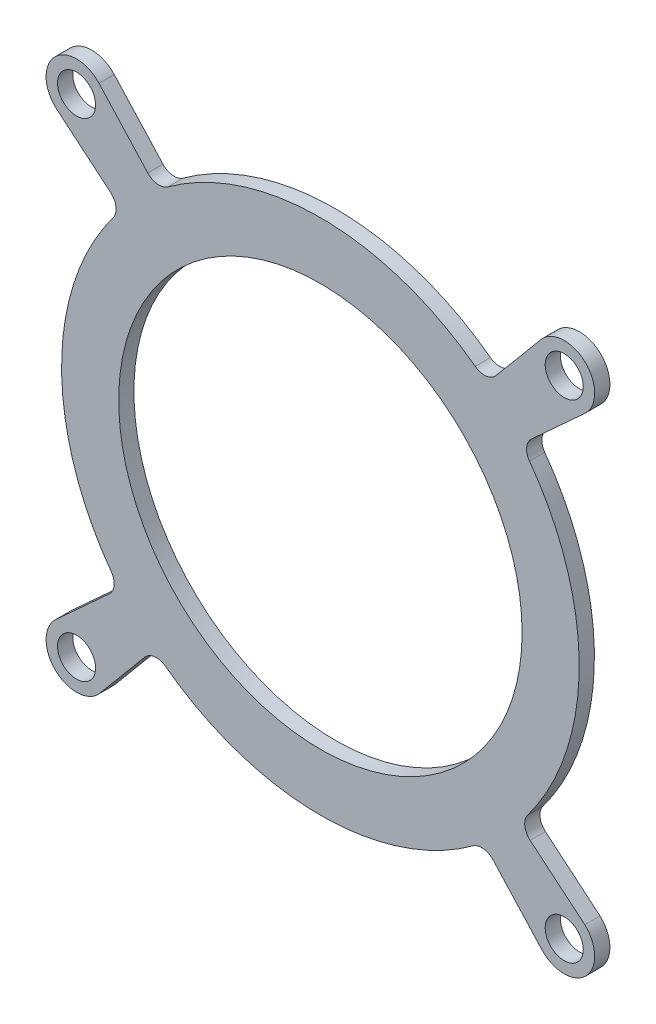
from build123d import *

# Parameters (mm, degrees)
SKETCH_1_R      = 2.5
SKETCH_1_R_2    = 26.5
EXTRUDE_1_DEPTH = 2


with BuildPart() as part:
    # 草图1 → 凸台-拉伸1 (new body)
    with BuildSketch(Plane.XY):
        with BuildLine():
            Line((29.084941375, -34.299138035), (22.681496979, -27.303615871))
            ThreePointArc((22.681496979, -27.303615871), (21.405560026, -26.66397773), (20.028107344, -27.037844244))
            ThreePointArc((20.028107344, -27.037844244), (-0.197152183, -33.562285535), (-20.34538772, -26.803730817))
            ThreePointArc((-20.34538772, -26.803730817), (-21.773876316, -26.419601836), (-23.075616614, -27.122173496))
            Line((-23.075616614, -27.122173496), (-29.084941375, -34.299138035))
            ThreePointArc((-29.084941375, -34.299138035), (-34.863899846, -34.426756989), (-34.736280892, -28.647798518))
            Line((-34.736280892, -28.647798518), (-27.740758728, -22.244354122))
            ThreePointArc((-27.740758728, -22.244354122), (-27.101120587, -20.968417169), (-27.474987101, -19.590964487))
            ThreePointArc((-27.474987101, -19.590964487), (-33.999428392, 0.634295041), (-27.240873674, 20.782530577))
            ThreePointArc((-27.240873674, 20.782530577), (-26.856744694, 22.211019173), (-27.559316353, 23.512759472))
            Line((-27.559316353, 23.512759472), (-34.736280892, 29.522084232))
            ThreePointArc((-34.736280892, 29.522084232), (-34.863899846, 35.301042704), (-29.084941375, 35.173423749))
            Line((-29.084941375, 35.173423749), (-22.681496979, 28.177901585))
            ThreePointArc((-22.681496979, 28.177901585), (-21.405560026, 27.538263444), (-20.028107344, 27.912129958))
            ThreePointArc((-20.028107344, 27.912129958), (0.197152183, 34.43657125), (20.34538772, 27.678016531))
            ThreePointArc((20.34538772, 27.678016531), (21.773876316, 27.293887551), (23.075616614, 27.99645921))
            Line((23.075616614, 27.99645921), (29.084941375, 35.173423749))
            ThreePointArc((29.084941375, 35.173423749), (34.863899846, 35.301042704), (34.736280892, 29.522084232))
            Line((34.736280892, 29.522084232), (27.740758728, 23.118639836))
            ThreePointArc((27.740758728, 23.118639836), (27.101120587, 21.842702883), (27.474987101, 20.465250201))
            ThreePointArc((27.474987101, 20.465250201), (33.999428392, 0.239990674), (27.240873674, -19.908244863))
            ThreePointArc((27.240873674, -19.908244863), (26.856744694, -21.336733459), (27.559316353, -22.638473757))
            Line((27.559316353, -22.638473757), (34.736280892, -28.647798518))
            ThreePointArc((34.736280892, -28.647798518), (34.863899846, -34.426756989), (29.084941375, -34.299138035))
        make_face()
        with Locations((32.035472722, -31.598329865)):
            Circle(SKETCH_1_R, mode=Mode.SUBTRACT)
        with Locations((-32.035472722, -31.598329865)):
            Circle(SKETCH_1_R, mode=Mode.SUBTRACT)
        with Locations((-32.035472722, 32.472615579)):
            Circle(SKETCH_1_R, mode=Mode.SUBTRACT)
        with Locations((32.035472722, 32.472615579)):
            Circle(SKETCH_1_R, mode=Mode.SUBTRACT)
        with Locations((0, 0.437142857)):
            Circle(SKETCH_1_R_2, mode=Mode.SUBTRACT)
    extrude(amount=EXTRUDE_1_DEPTH)


solid = part.part
